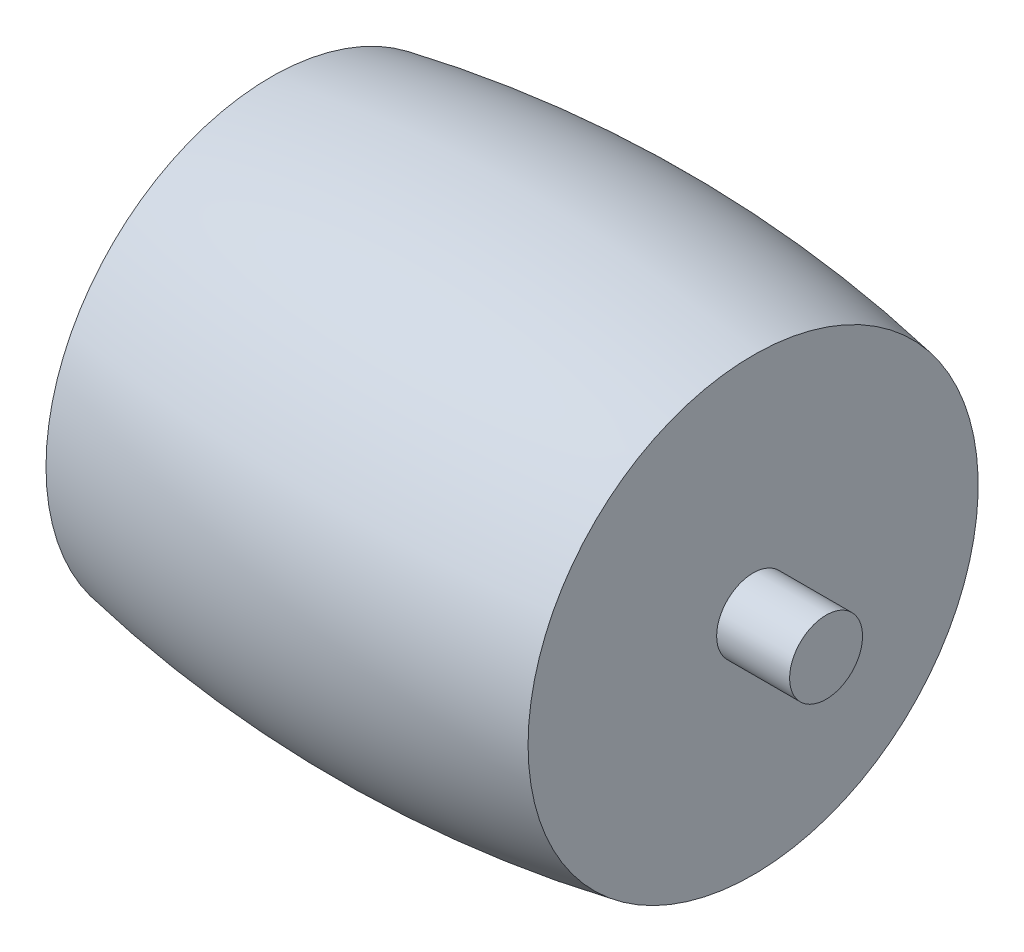
from build123d import *

# Parameters (mm, degrees)
SCALE1_SCALE = 0.24


with BuildPart() as part:
    # Sketch1 → Revolve1 (revolve)
    with BuildSketch(Plane.XY, mode=Mode.PRIVATE) as revolve1_sk:
        with BuildLine():
            Line((9.25, 49.136926033), (9.25, 41.9))
            Line((9.25, 41.9), (12.05, 41.9))
            Line((12.05, 41.9), (12.05, 40.5))
            Line((12.05, 40.5), (9.25, 40.5))
            Line((9.25, 40.5), (-9.25, 40.5))
            Line((-9.25, 40.5), (-12.05, 40.5))
            Line((-12.05, 40.5), (-12.05, 41.9))
            Line((-12.05, 41.9), (-9.25, 41.9))
            Line((-9.25, 41.9), (-9.25, 49.136926033))
            ThreePointArc((-9.25, 49.136926033), (0, 50), (9.25, 49.136926033))
        make_face()
    revolve(revolve1_sk.sketch.rotate(Axis((-9.25, 40.5, 0), (1, 0, 0)), 90), axis=Axis((-9.25, 40.5, 0), (1, 0, 0)))


with BuildPart() as part_1:
    # Scale1: scaled about (0, 40.5, 0)
    add(part.part.scale(SCALE1_SCALE).moved(Location((0, 30.78, 0))))


solid = part_1.part
